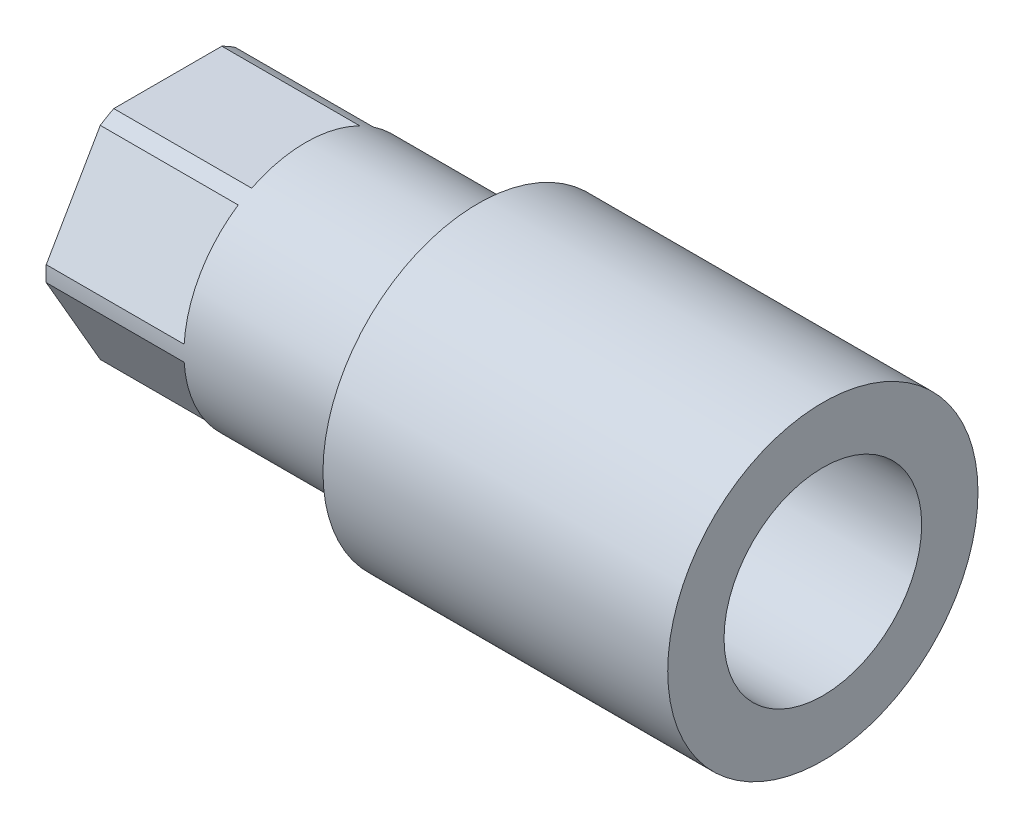
from build123d import *

# Parameters (mm, degrees)
CUT_EXTRUDE2_DEPTH = 12


with BuildPart() as part:
    # Sketch1 → Revolve1 (revolve)
    with BuildSketch(Plane.XY, mode=Mode.PRIVATE) as revolve1_sk:
        Polygon((57, -13.5), (27, -13.5), (27, -10.6), (0, -10.6), (0, -3.175), (34, -3.175), (34, -8.6), (57, -8.6), align=None)
    revolve(revolve1_sk.sketch.rotate(Axis((0, 0, 0), (1, 0, 0)), 270), axis=Axis((0, 0, 0), (1, 0, 0)))

    # Sketch2 → Cut-Extrude2 (cut)
    with BuildSketch(Plane.ZY):
        with BuildLine():
            Line((-10.578304925, 0.677838412), (-5.876177747, 8.822161588))
            ThreePointArc((-5.876177747, 8.822161588), (-9.17986928, 5.3), (-10.578304925, 0.677838412))
        make_face()
        with BuildLine():
            ThreePointArc((4.702127178, 9.5), (0, 10.6), (-4.702127178, 9.5))
            Line((-4.702127178, 9.5), (4.702127178, 9.5))
        make_face()
        with BuildLine():
            Line((-5.876177747, -8.822161588), (-10.578304925, -0.677838412))
            ThreePointArc((-10.578304925, -0.677838412), (-9.17986928, -5.3), (-5.876177747, -8.822161588))
        make_face()
        with BuildLine():
            ThreePointArc((10.578304925, 0.677838412), (9.17986928, 5.3), (5.876177747, 8.822161588))
            Line((5.876177747, 8.822161588), (10.578304925, 0.677838412))
        make_face()
        with BuildLine():
            Line((4.702127178, -9.5), (-4.702127178, -9.5))
            ThreePointArc((-4.702127178, -9.5), (0, -10.6), (4.702127178, -9.5))
        make_face()
        with BuildLine():
            ThreePointArc((5.876177747, -8.822161588), (9.17986928, -5.3), (10.578304925, -0.677838412))
            Line((10.578304925, -0.677838412), (5.876177747, -8.822161588))
        make_face()
    extrude(amount=-CUT_EXTRUDE2_DEPTH, mode=Mode.SUBTRACT)


solid = part.part
